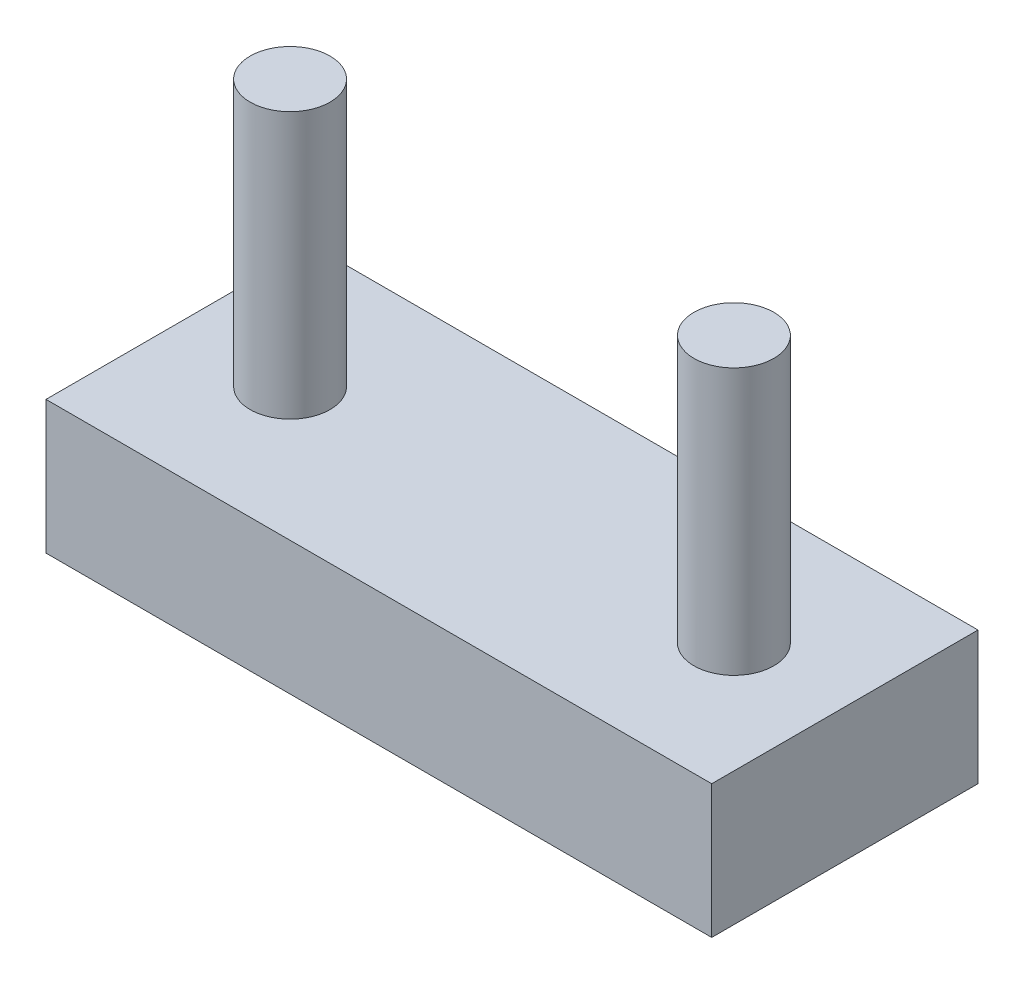
from build123d import *

# Parameters (mm, degrees)
CROQUIS1_W              = 25
CROQUIS1_H              = 10
SALIENTE_EXTRUIR1_DEPTH = 5
CROQUIS2_R              = 1.5
SALIENTE_EXTRUIR2_DEPTH = 10


with BuildPart() as part:
    # Croquis1 → Saliente-Extruir1 (new body)
    with BuildSketch(Plane(origin=(0, 0, 0), x_dir=(1, 0, 0), z_dir=(0, 1, 0))):
        with Locations((12.5, 5)):
            Rectangle(CROQUIS1_W, CROQUIS1_H)
    extrude(amount=SALIENTE_EXTRUIR1_DEPTH)

    # Croquis2 → Saliente-Extruir2 (add)
    with BuildSketch(Plane(origin=(0, 5, 0), x_dir=(1, 0, 0), z_dir=(0, 1, 0))):
        with Locations(Location((4.1665, 5, 0), (0, 0, 90))):
            Circle(CROQUIS2_R)
        with Locations(Location((20.8335, 5, 0), (0, 0, 90))):
            Circle(CROQUIS2_R)
    extrude(amount=SALIENTE_EXTRUIR2_DEPTH)


solid = part.part
